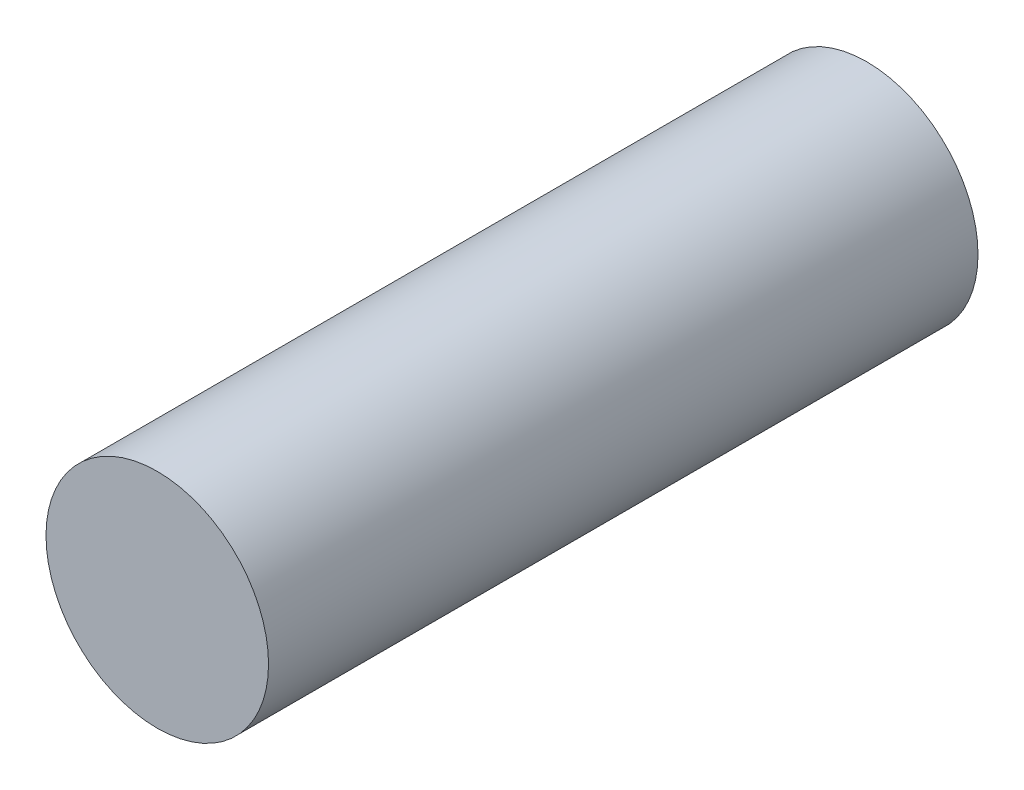
from build123d import *

# Parameters (mm, degrees)
SKETCH1_R           = 9.755
BOSS_EXTRUDE1_DEPTH = 62.2


with BuildPart() as part:
    # Sketch1 → Boss-Extrude1 (new body)
    with BuildSketch(Plane.XY):
        with Locations(Location((0, 0, 0), (0, 0, 180))):
            Circle(SKETCH1_R)
    extrude(amount=BOSS_EXTRUDE1_DEPTH)


solid = part.part
